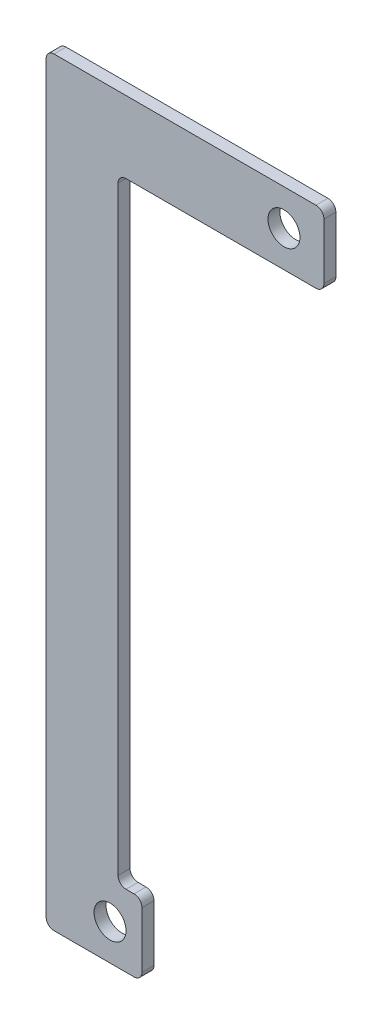
from build123d import *

# Parameters (mm, degrees)
SKETCH1_R           = 2
BOSS_EXTRUDE1_DEPTH = 1.5


with BuildPart() as part:
    # Sketch1 → Boss-Extrude1 (new body)
    with BuildSketch(Plane.XY):
        with BuildLine():
            Line((12, 8), (12, 1))
            ThreePointArc((12, 1), (11.707106781, 0.292893219), (11, 0))
            Line((11, 0), (1, 0))
            ThreePointArc((1, 0), (0.292893219, 0.292893219), (0, 1))
            Line((0, 1), (0, 94.000005673))
            ThreePointArc((0, 94.000005673), (0.292893219, 94.707112454), (1, 95.000005673))
            Line((1, 95.000005673), (33.760008368, 95.000005673))
            ThreePointArc((33.760008368, 95.000005673), (34.467115149, 94.707112454), (34.760008368, 94.000005673))
            Line((34.760008368, 94.000005673), (34.760008368, 87.000005673))
            ThreePointArc((34.760008368, 87.000005673), (34.467115149, 86.292898892), (33.760008368, 86.000005673))
            Line((33.760008368, 86.000005673), (10, 86.000005673))
            ThreePointArc((10, 86.000005673), (9.292893219, 85.707112454), (9, 85.000005673))
            Line((9, 85.000005673), (9, 10))
            ThreePointArc((9, 10), (9.292893219, 9.292893219), (10, 9))
            Line((10, 9), (11, 9))
            ThreePointArc((11, 9), (11.707106781, 8.707106781), (12, 8))
        make_face()
        with Locations((29.760008368, 90.500005673)):
            Circle(SKETCH1_R, mode=Mode.SUBTRACT)
        with Locations((8, 4.5)):
            Circle(SKETCH1_R, mode=Mode.SUBTRACT)
    extrude(amount=BOSS_EXTRUDE1_DEPTH)


solid = part.part
